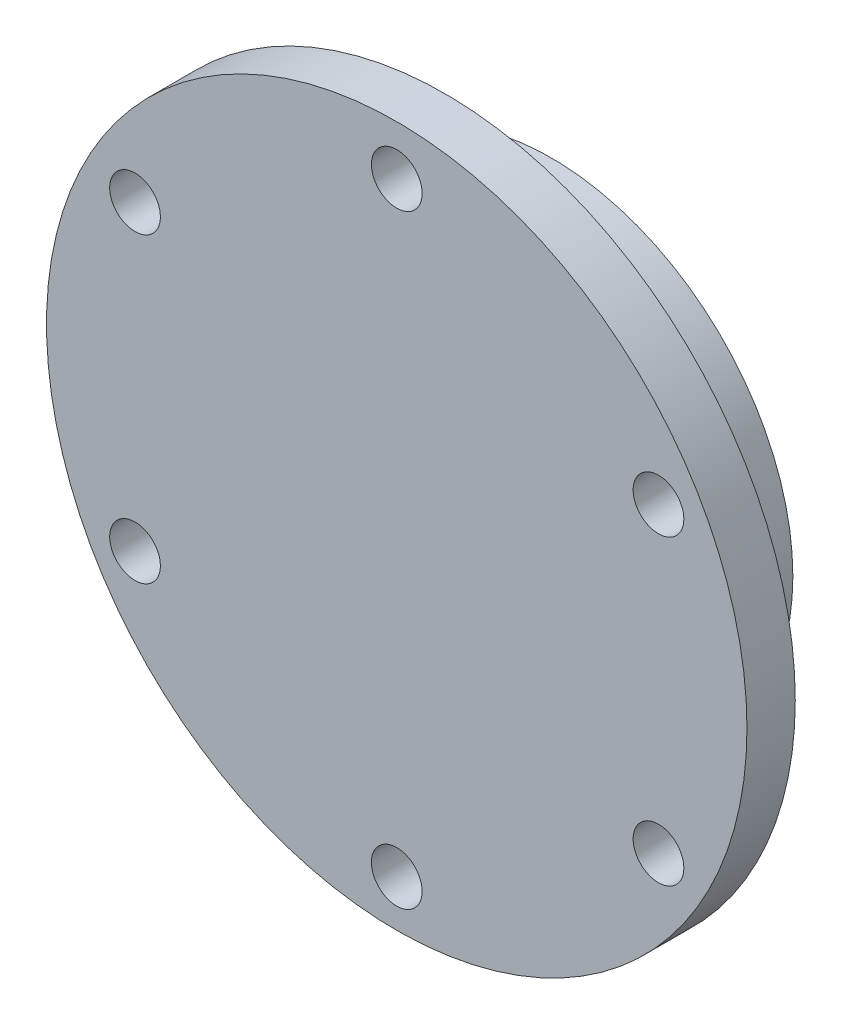
from build123d import *

# Parameters (mm, degrees)
CROQUIS1_R              = 72.5
SALIENTE_EXTRUIR1_DEPTH = 10
MATRIZC3_COUNT          = 6
CROQUIS13_R             = 50
SALIENTE_EXTRUIR2_DEPTH = 22


with BuildPart() as part:
    # Croquis1 → Saliente-Extruir1 (new body)
    with BuildSketch(Plane.XY):
        Circle(CROQUIS1_R)
    extrude(amount=SALIENTE_EXTRUIR1_DEPTH)

    # Croquis12 → Taladro roscado M12x1.51 (revolve, cut)
    with BuildSketch(Plane(origin=(0, 62.233623097, 0), x_dir=(0, 1, 0), z_dir=(1, 0, 0))):
        Polygon((0, 0), (0, 34.65451825), (5.25, 31.5), (5.25, 0), align=None)
    taladro_roscado_m12x1_51 = revolve(axis=Axis((0, 62.233623097, -6.35), (0, 0, 1)), mode=Mode.SUBTRACT)

    # MatrizC3: Taladro roscado M12x1.51 ×6 about axis
    matrizc3_axis = Axis((0, -0.328058282, 0), (0, 0, 1))
    for i in range(1, MATRIZC3_COUNT):
        add(taladro_roscado_m12x1_51.rotate(matrizc3_axis, i * 360 / MATRIZC3_COUNT), mode=Mode.SUBTRACT)

    # Croquis13 → Saliente-Extruir2 (add)
    with BuildSketch(Plane(origin=(0, 0, 0), x_dir=(-1, 0, 0), z_dir=(0, 0, -1))):
        Circle(CROQUIS13_R)
    extrude(amount=SALIENTE_EXTRUIR2_DEPTH)


solid = part.part
